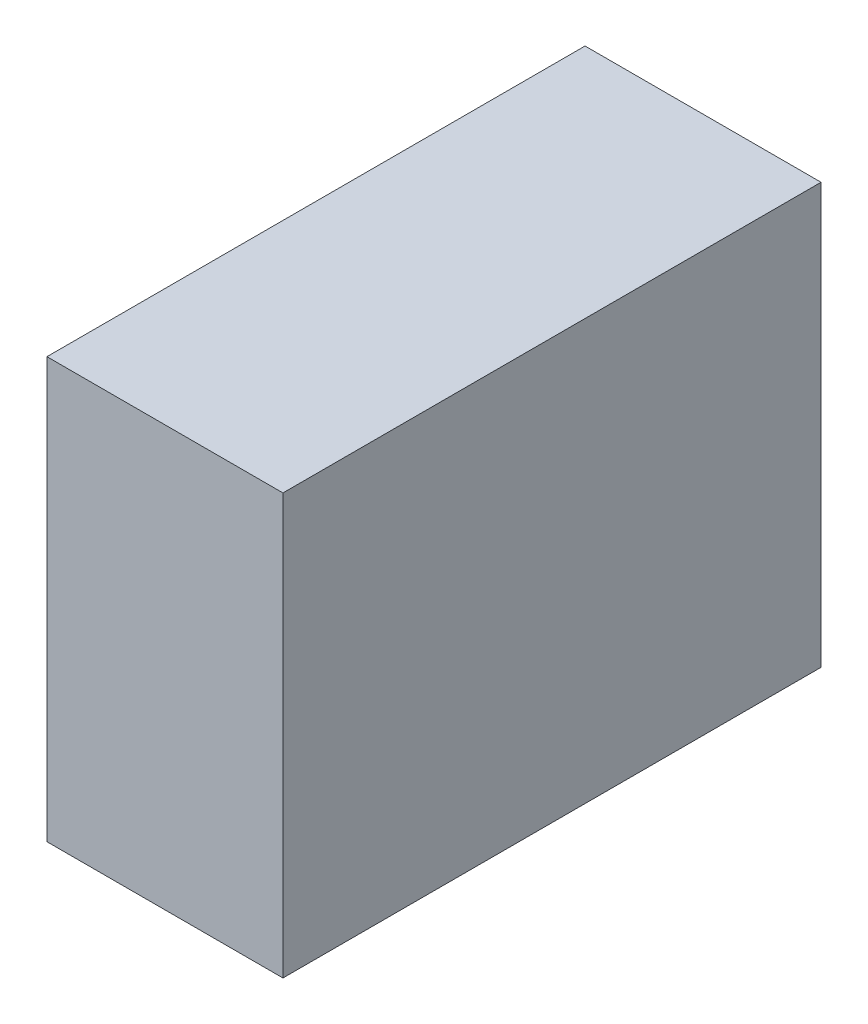
from build123d import *

# Parameters (mm, degrees)
ESBO_O1_W                = 50
ESBO_O1_H                = 89
RESSALTO_EXTRUS_O1_DEPTH = 114


with BuildPart() as part:
    # Esboço1 → Ressalto-extrusão1 (new body)
    with BuildSketch(Plane.XY):
        with Locations((25, 44.5)):
            Rectangle(ESBO_O1_W, ESBO_O1_H)
    extrude(amount=RESSALTO_EXTRUS_O1_DEPTH)


solid = part.part
